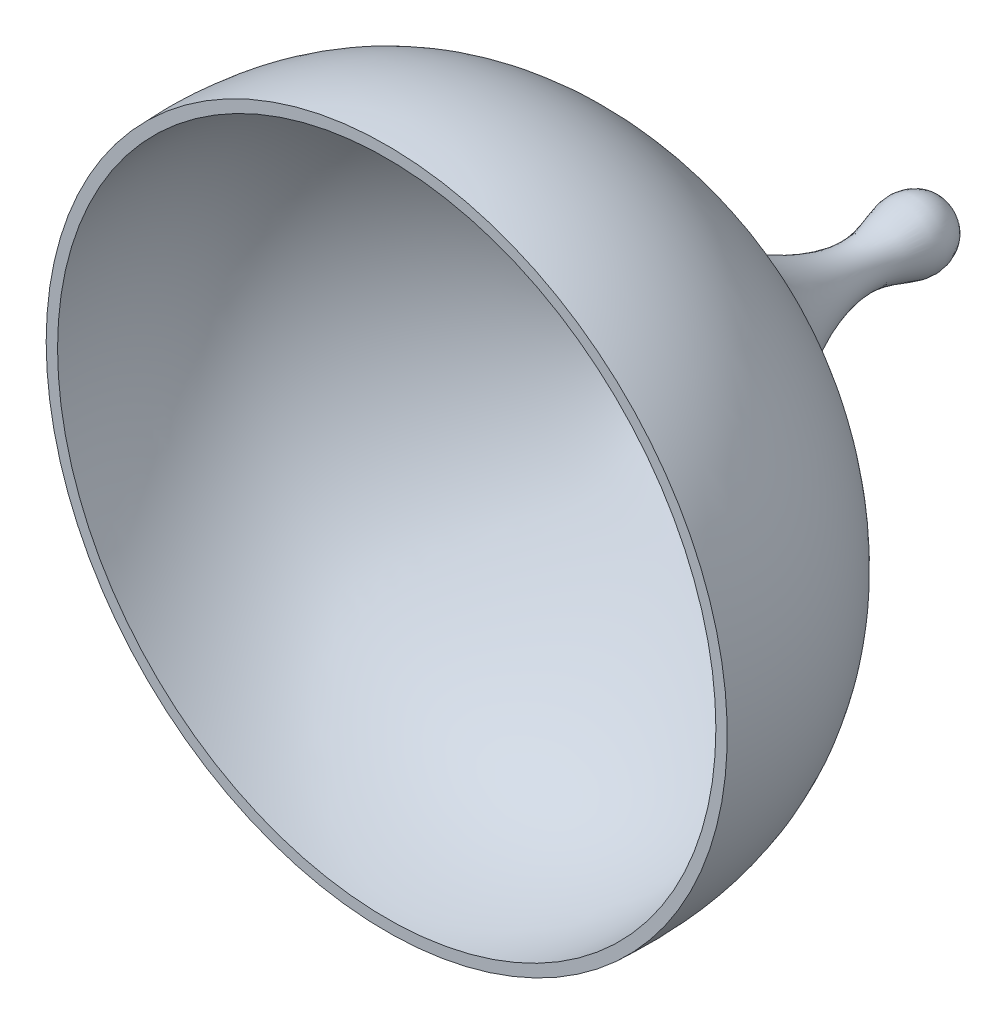
from build123d import *


with BuildPart() as part:
    # Esboço1 → Revolução7 (revolve)
    with BuildSketch(Plane(origin=(0, 0, 0), x_dir=(1, 0, 0), z_dir=(0, 1, 0))):
        with BuildLine():
            Line((-10.765, -17.5), (-10.405, -17.5))
            add(Edge.make_bspline(
                [(-10.405, -17.5), (-10.491918376, -15.972913095), (-10.289862511, -13.193786618), (-7.831563539, -10.516932335), (-5.398773636, -8.786732695), (-3.079079494, -7.557324851), (-1.132715303, -5.786256977), (-0.123256744, -3.462298568), (-0.49776554, -1.696257639), (-0.638555031, -0.715178522), (-0.38627868, -0.438341377), (-0.133039806, -0.447130164), (0, -0.455174069)],
                knots=[0, 0, 0, 0, 0.216943181, 0.356230711, 0.487330528, 0.631026616, 0.717013879, 0.849541701, 0.954579257, 0.967567011, 0.980973009, 1, 1, 1, 1], degree=3))
            Line((0, -0.455174069), (0, 0))
            add(Edge.make_bspline(
                [(-10.765, -17.5), (-10.912328942, -14.597831521), (-9.429536644, -10.148464539), (-3.08829735, -7.331521693), (-1.757338515, -5.823762722), (-0.887493284, -4.054906644), (-0.368296125, -2.394638771), (-1.336699492, -0.77183869), (-0.554994154, 0.293704995), (0, 0)],
                knots=[0, 0, 0, 0, 0.375612557, 0.736040324, 0.831842268, 0.85012324, 0.918850042, 0.959344166, 1, 1, 1, 1], degree=3))
        make_face()
    revolve(axis=Axis((0, 0, 0), (0, 0, 1)))


solid = part.part
